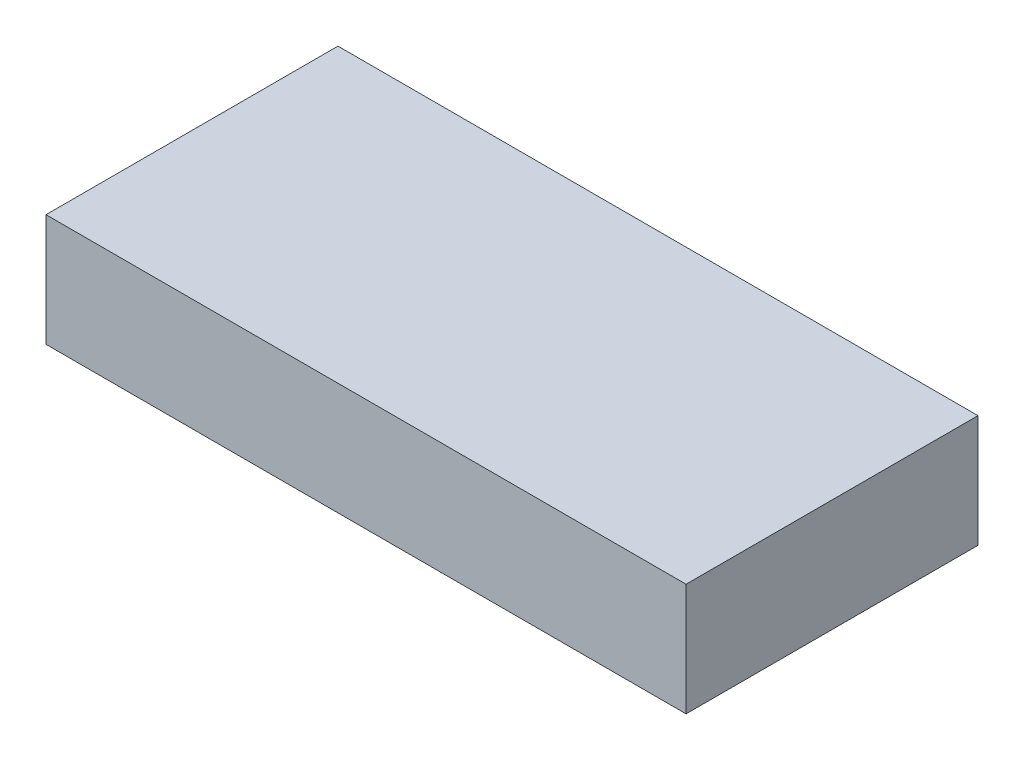
from build123d import *

# Parameters (mm, degrees)
SKETCH1_W           = 28.5
SKETCH1_H           = 13
BOSS_EXTRUDE1_DEPTH = 2.5


with BuildPart() as part:
    # Sketch1 → Boss-Extrude1 (new, symmetric)
    with BuildSketch(Plane(origin=(0, 0, 0), x_dir=(1, 0, 0), z_dir=(0, 1, 0))):
        Rectangle(SKETCH1_W, SKETCH1_H)
    extrude(amount=BOSS_EXTRUDE1_DEPTH, both=True)


solid = part.part
